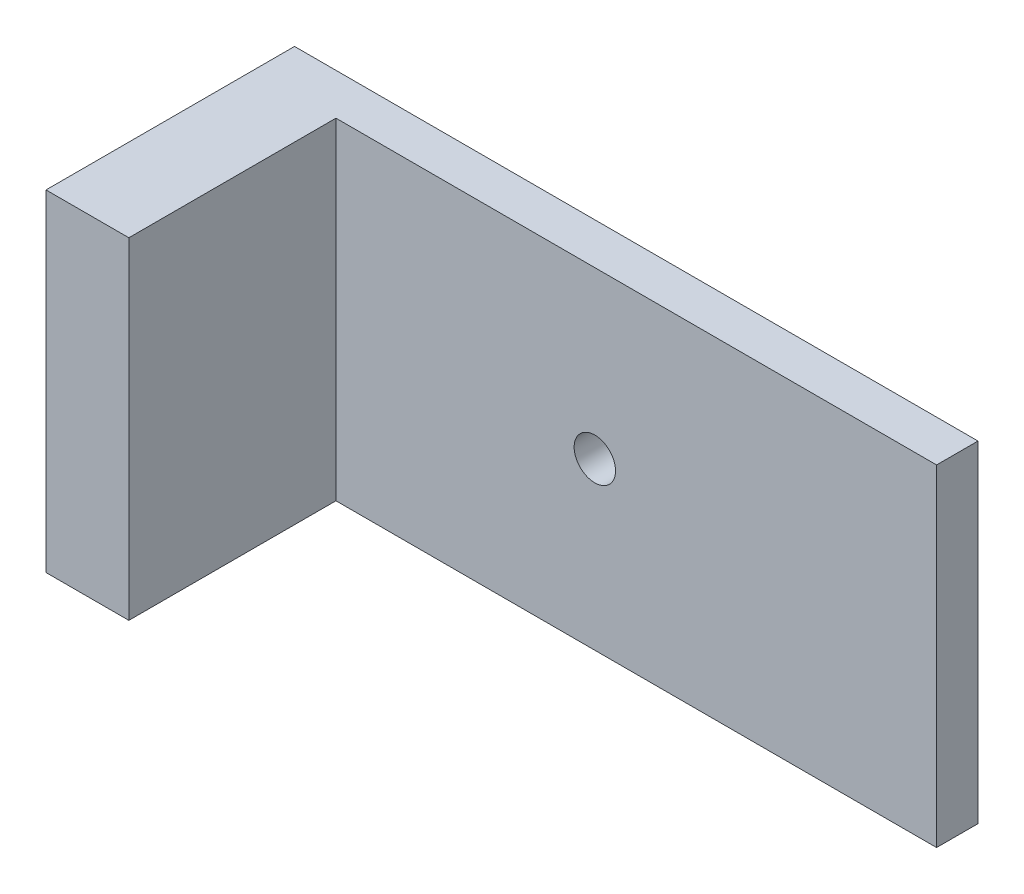
from build123d import *

# Parameters (mm, degrees)
SKETCH1_W           = 165
SKETCH1_H           = 80
BOSS_EXTRUDE1_DEPTH = 10
SKETCH2_W           = 20
SKETCH2_H           = 80
BOSS_EXTRUDE2_DEPTH = 50
CUT_EXTRUDE1_REACH  = 106.433
SKETCH3_R           = 5


with BuildPart() as part:
    # Sketch1 → Boss-Extrude1 (new body)
    with BuildSketch(Plane.XY):
        Rectangle(SKETCH1_W, SKETCH1_H)
    extrude(amount=BOSS_EXTRUDE1_DEPTH)

    # Sketch2 → Boss-Extrude2 (add)
    with BuildSketch(Plane.XY.offset(10)):
        with Locations((-72.5, 0)):
            Rectangle(SKETCH2_W, SKETCH2_H)
    extrude(amount=BOSS_EXTRUDE2_DEPTH)

    # Sketch3 → Cut-Extrude1 (cut, up to next)
    with BuildSketch(Plane.XY.offset(10), mode=Mode.PRIVATE) as cut_extrude1_sk1:
        Circle(SKETCH3_R)
    cut_extrude1_tool1 = extrude(cut_extrude1_sk1.sketch, amount=-CUT_EXTRUDE1_REACH, mode=Mode.PRIVATE) & part.part
    add(cut_extrude1_tool1.solids().sort_by_distance((0, 0, 10))[0], mode=Mode.SUBTRACT)


solid = part.part
